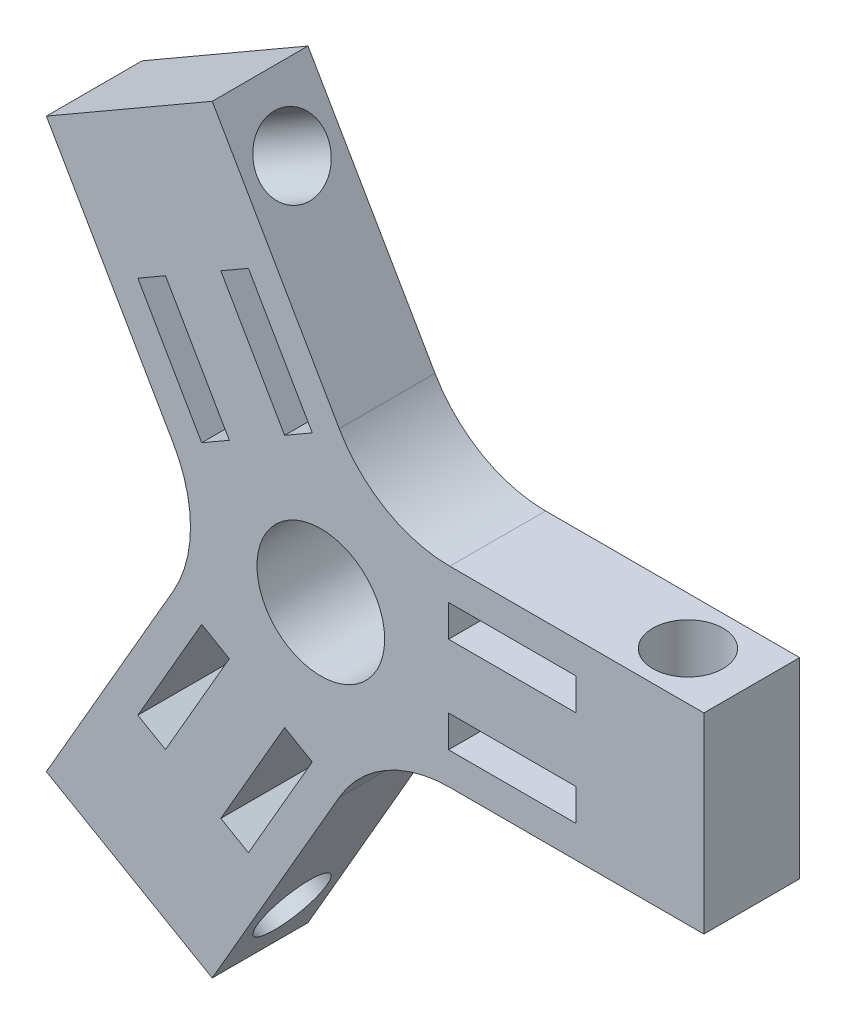
from build123d import *

# Parameters (mm, degrees)
BOSS_EXTRU_4_DEPTH      = 15
ESQUISSE4_R             = 10
ESQUISSE4_W             = 20
ESQUISSE4_H             = 5
ENL_V_MAT_EXTRU_3_DEPTH = 15
ESQUISSE5_R             = 5.5
ENL_V_MAT_EXTRU_4_DEPTH = 50
CONG_10_R               = 20
CONG_11_R               = 20
CONG_12_R               = 20
ESQUISSE6_R             = 5.5
ENL_V_MAT_EXTRU_5_DEPTH = 50
ESQUISSE7_R             = 5.5
ENL_V_MAT_EXTRU_6_DEPTH = 50


with BuildPart() as part:
    # Esquisse1 → Boss.-Extru.4 (new body)
    with BuildSketch(Plane.XY):
        Polygon((60, 0), (60, -15), (8.660254038, -15), (-17.009618943, -59.461524227), (-30, -51.961524227), (-42.990381057, -44.461524227), (-17.320508076, 0), (-42.990381057, 44.461524227), (-30, 51.961524227), (-17.009618943, 59.461524227), (8.660254038, 15), (60, 15), align=None)
    extrude(amount=BOSS_EXTRU_4_DEPTH)

    # Esquisse4 → Enlèv. mat.-Extru.3 (cut)
    with BuildSketch(Plane.XY.offset(15)):
        Circle(ESQUISSE4_R)
        Polygon((-11.339745962, -39.641016151), (-1.339745962, -22.320508076), (-5.669872981, -19.820508076), (-15.669872981, -37.141016151), align=None)
        with Locations((30, 7.5)):
            Rectangle(ESQUISSE4_W, ESQUISSE4_H)
        with Locations((30, -7.5)):
            Rectangle(ESQUISSE4_W, ESQUISSE4_H)
        Polygon((-24.330127019, -32.141016151), (-28.660254038, -29.641016151), (-18.660254038, -12.320508076), (-14.330127019, -14.820508076), align=None)
        Polygon((-28.660254038, 29.641016151), (-18.660254038, 12.320508076), (-14.330127019, 14.820508076), (-24.330127019, 32.141016151), align=None)
        Polygon((-15.669872981, 37.141016151), (-11.339745962, 39.641016151), (-1.339745962, 22.320508076), (-5.669872981, 19.820508076), align=None)
    extrude(amount=-ENL_V_MAT_EXTRU_3_DEPTH, mode=Mode.SUBTRACT)

    # Esquisse5 → Enlèv. mat.-Extru.4 (cut)
    with BuildSketch(Plane(origin=(12.990381057, -7.5, 0), x_dir=(0, 0, -1), z_dir=(0.8660254037844365, -0.500000000000004, 0))):
        with Locations(Location((-7.5, -50, 0), (0, 0, 90))):
            Circle(ESQUISSE5_R)
    extrude(amount=-ENL_V_MAT_EXTRU_4_DEPTH, mode=Mode.SUBTRACT)

    # Congé10
    cong_10_edges = [part.edges().sort_by_distance(p)[0] for p in [
        (8.660254038, -15, 7.5),
    ]]
    fillet(cong_10_edges, radius=CONG_10_R)

    # Congé11
    cong_11_edges = [part.edges().sort_by_distance(p)[0] for p in [
        (8.660254038, 15, 7.5),
    ]]
    fillet(cong_11_edges, radius=CONG_11_R)

    # Congé12
    cong_12_edges = [part.edges().sort_by_distance(p)[0] for p in [
        (-17.320508076, 0, 7.5),
    ]]
    fillet(cong_12_edges, radius=CONG_12_R)

    # Esquisse6 → Enlèv. mat.-Extru.5 (cut)
    with BuildSketch(Plane(origin=(12.990381057, 7.5, 0), x_dir=(0, 0, -1), z_dir=(0.8660254037844445, 0.49999999999998984, 0))):
        with Locations(Location((-7.5, 50, 0), (0, 0, 90))):
            Circle(ESQUISSE6_R)
    extrude(amount=-ENL_V_MAT_EXTRU_5_DEPTH, mode=Mode.SUBTRACT)

    # Esquisse7 → Enlèv. mat.-Extru.6 (cut)
    with BuildSketch(Plane(origin=(0, 15, 0), x_dir=(1, 0, 0), z_dir=(0, 1, 0))):
        with Locations(Location((50, -7.5, 0), (0, 0, 270))):
            Circle(ESQUISSE7_R)
    extrude(amount=-ENL_V_MAT_EXTRU_6_DEPTH, mode=Mode.SUBTRACT)


solid = part.part
